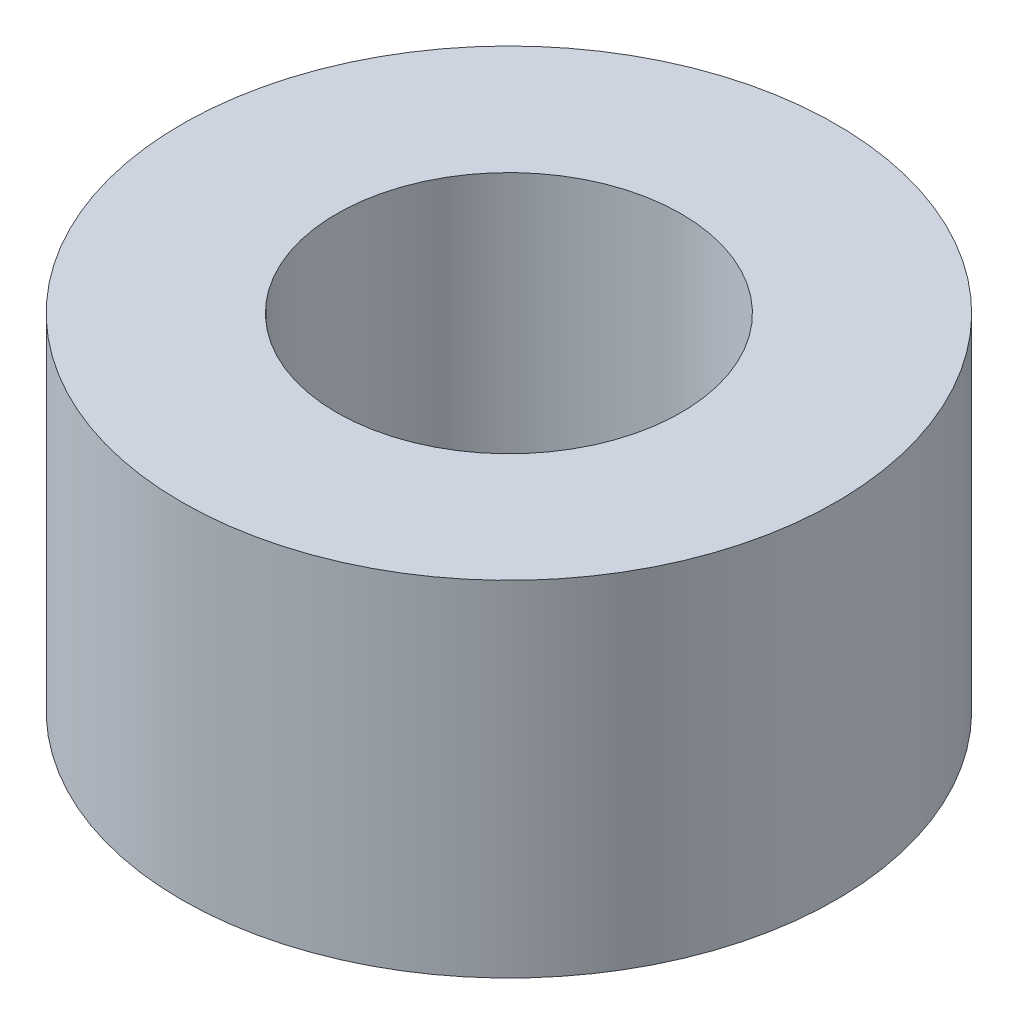
from build123d import *

# Parameters (mm, degrees)
SKETCH_1_R      = 9.5
SKETCH_1_R_2    = 5
EXTRUDE_1_DEPTH = 10


with BuildPart() as part:
    # 草图1 → 凸台-拉伸1 (new body)
    with BuildSketch(Plane(origin=(0, 0, 0), x_dir=(1, 0, 0), z_dir=(0, 1, 0))):
        with Locations(Location((0, 0, 0), (0, 0, 270))):
            Circle(SKETCH_1_R)
        with Locations(Location((0, 0, 0), (0, 0, 270))):
            Circle(SKETCH_1_R_2, mode=Mode.SUBTRACT)
    extrude(amount=EXTRUDE_1_DEPTH)


solid = part.part
